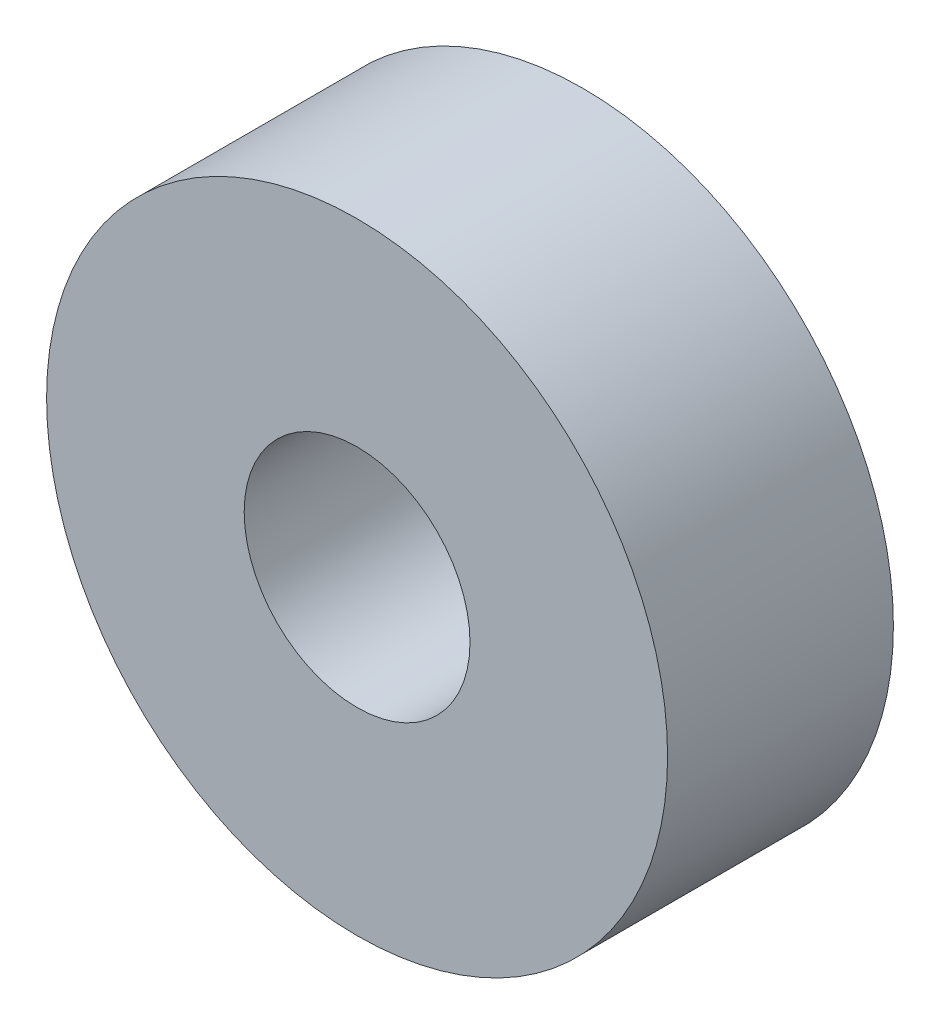
from build123d import *

# Parameters (mm, degrees)
SKETCH_1_R      = 11
SKETCH_1_R_2    = 4
EXTRUDE_1_DEPTH = 8


with BuildPart() as part:
    # Эскиз1 → Бобышка-Вытянуть1 (new body)
    with BuildSketch(Plane.XY):
        Circle(SKETCH_1_R)
        Circle(SKETCH_1_R_2, mode=Mode.SUBTRACT)
    extrude(amount=EXTRUDE_1_DEPTH)


solid = part.part
